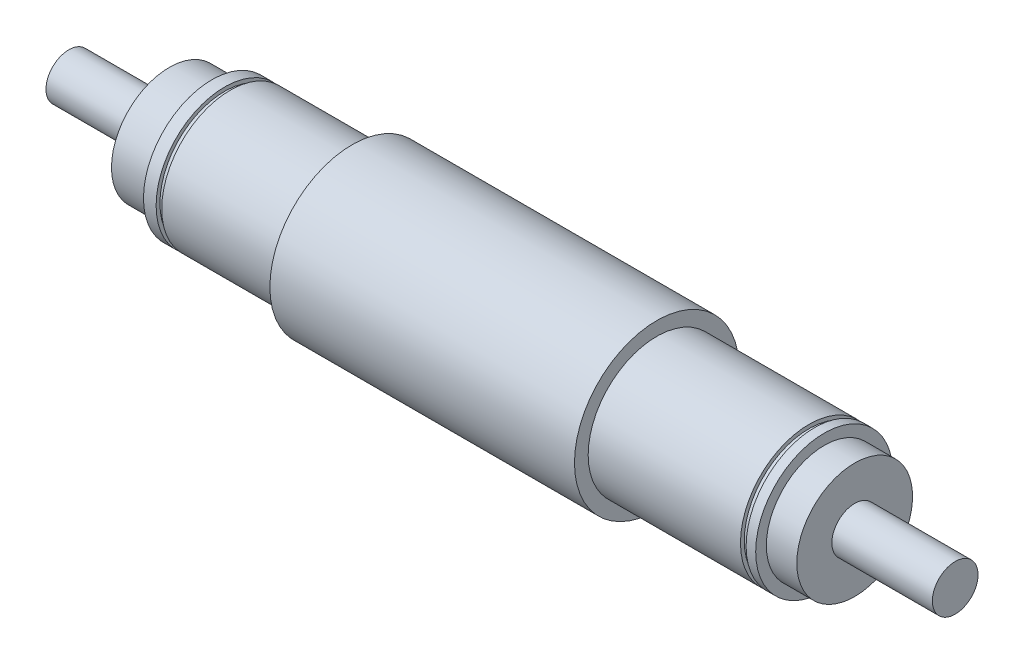
from build123d import *

# Parameters (mm, degrees)
SCHIZZO2_W   = 1.6
SCHIZZO2_H   = 6.8
SCHIZZO2_W_2 = 1.85
SCHIZZO2_H_2 = 1.25


with BuildPart() as part:
    # Schizzo1 → Rivoluzione1 (revolve)
    with BuildSketch(Plane.XY, mode=Mode.PRIVATE) as rivoluzione1_sk:
        Polygon((0, 0), (291, 0), (291, 7.5), (258, 7.5), (258, 19), (248, 19), (248, 22.5), (193, 22.5), (193, 27), (93, 27), (93, 22.5), (47, 22.5), (47, 19), (33, 19), (33, 7.5), (0, 7.5), align=None)
    revolve(rivoluzione1_sk.sketch.rotate(Axis((0, 0, 0), (1, 0, 0)), 90), axis=Axis((0, 0, 0), (1, 0, 0)))

    # Schizzo2 → Taglia-Rivoluzione1 (revolve, cut)
    with BuildSketch(Plane.XY, mode=Mode.PRIVATE) as taglia_rivoluzione1_sk:
        with Locations((5.2, 10.9)):
            Rectangle(SCHIZZO2_W, SCHIZZO2_H)
        with Locations((52.075, 21.875)):
            Rectangle(SCHIZZO2_W_2, SCHIZZO2_H_2)
        with Locations((243.925, 21.875)):
            Rectangle(SCHIZZO2_W_2, SCHIZZO2_H_2)
        with Locations((285.8, 10.9)):
            Rectangle(SCHIZZO2_W, SCHIZZO2_H)
    revolve(taglia_rivoluzione1_sk.sketch.rotate(Axis((0, 0, 0), (1, 0, 0)), 90), axis=Axis((0, 0, 0), (1, 0, 0)), mode=Mode.SUBTRACT)


solid = part.part
